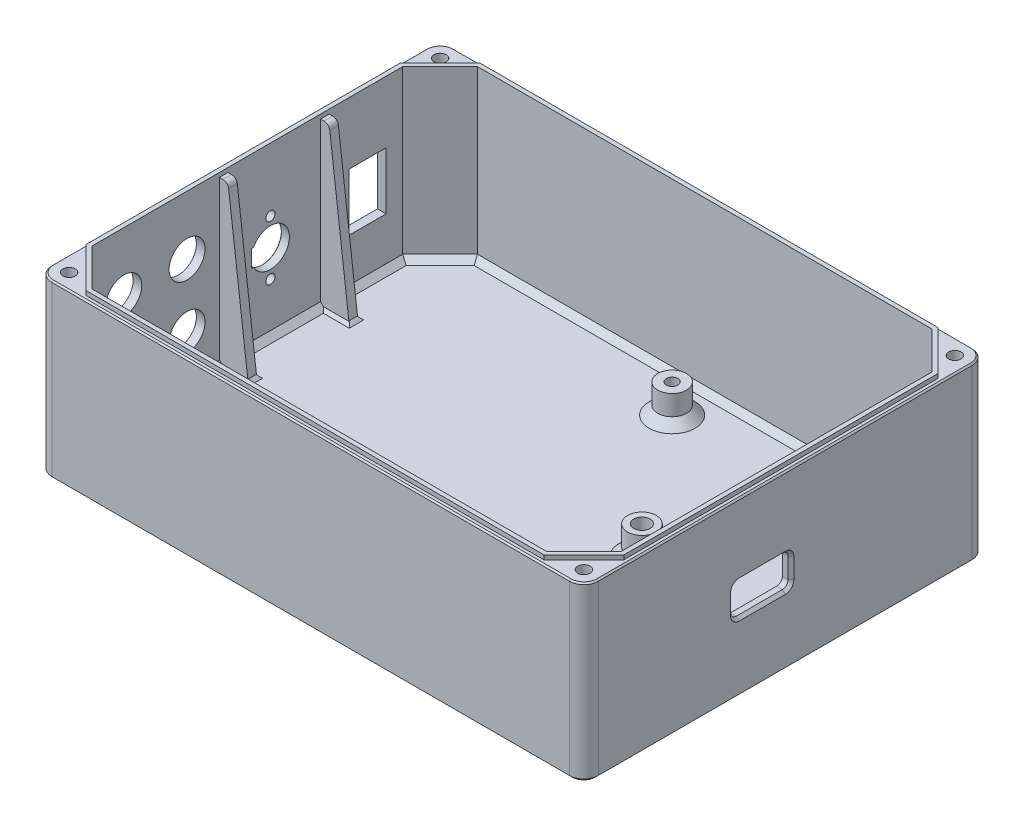
from build123d import *
from OCP.BRepFilletAPI import BRepFilletAPI_MakeChamfer

# Parameters (mm, degrees)
SKETCH2_W                      = 190
SKETCH2_H                      = 140
ENCLOSURE_BODY_DEPTH           = 60
FILLET1_R                      = 5
SHELL1_T                       = -3
SKETCH3_R                      = 5
SKETCH3_R_2                    = 2
SKETCH3_R_3                    = 2.85
PCB_SUPPORTS_DEPTH             = 10
ENCLOSURE_START                = 57
ENCLOSURE_CORNER_FLANGES_DEPTH = 57
SKETCH8_R                      = 3.8
CUT_EXTRUDE1_DEPTH             = 45.5
SKETCH9_R                      = 2.15
CUT_EXTRUDE2_DEPTH             = 127.472328989
CHAMFER1_SIZE                  = 2
USB_CUTOUT_DEPTH               = 6
SKETCH11_R                     = 1.6
SKETCH11_R_2                   = 6.25
SKETCH11_W                     = 12.9
SKETCH11_H                     = 19.9
BUTTON_CUTOUTS_DEPTH           = 6
CHAMFER3_SIZE                  = 1
SKETCH15_W                     = 3
SKETCH15_H                     = 12.65913529
SKETCH15_H_2                   = 57
BOSS_EXTRUDE6_DEPTH            = 10
CUT_EXTRUDE3_REACH             = 155.152
CHAMFER4_SIZE                  = 3
FILLET2_R                      = 2
BOSS_EXTRUDE7_DEPTH            = 1.5
CHAMFER5_SIZE                  = 1
CHAMFER5_SIZE2                 = 1.148564321
CHAMFER6_SIZE                  = 1
CHAMFER7_SIZE                  = 0.2
CHAMFER8_SIZE                  = 0.5


with BuildPart() as part:
    # Sketch2 → Enclosure body (new body)
    with BuildSketch(Plane(origin=(0, 0, 0), x_dir=(1, 0, 0), z_dir=(0, 1, 0))):
        Rectangle(SKETCH2_W, SKETCH2_H)
    extrude(amount=ENCLOSURE_BODY_DEPTH)

    # Fillet1
    fillet1_edges = [part.edges().sort_by_distance(p)[0] for p in [
        (95, 30, 70),
        (-95, 30, 70),
        (-95, 30, -70),
        (95, 30, -70),
    ]]
    fillet(fillet1_edges, radius=FILLET1_R)

    # Shell1
    shell1_openings = [part.faces().sort_by_distance(p)[0] for p in [
        (0, 60, 0),
    ]]
    offset(amount=SHELL1_T, openings=shell1_openings, kind=Kind.INTERSECTION)

    # Sketch3 → PCB Supports (add)
    # profile 1 of 5: a face of its own
    with BuildSketch(Plane(origin=(0, 3, 0), x_dir=(1, 0, 0), z_dir=(0, 1, 0))):
        with Locations(Location((1.270356621, 54.416611673, 0), (0, 0, 270))):
            Circle(SKETCH3_R)
        with Locations(Location((1.270356621, 54.416611673, 0), (0, 0, 270))):
            Circle(SKETCH3_R_2, mode=Mode.SUBTRACT)
    # profile 2 of 5: a face of its own
    with BuildSketch(Plane(origin=(0, 3, 0), x_dir=(1, 0, 0), z_dir=(0, 1, 0))):
        with Locations(Location((76.270356621, 54.416611673, 0), (0, 0, 270))):
            Circle(SKETCH3_R)
        with Locations(Location((76.270356621, 54.416611673, 0), (0, 0, 270))):
            Circle(SKETCH3_R_2, mode=Mode.SUBTRACT)
    # profile 3 of 5: a face of its own
    with BuildSketch(Plane(origin=(0, 3, 0), x_dir=(1, 0, 0), z_dir=(0, 1, 0))):
        with Locations(Location((76.270356621, -55.583388327, 0), (0, 0, 270))):
            Circle(SKETCH3_R)
        with Locations(Location((76.270356621, -55.583388327, 0), (0, 0, 270))):
            Circle(SKETCH3_R_2, mode=Mode.SUBTRACT)
    # profile 4 of 5: a face of its own
    with BuildSketch(Plane(origin=(0, 3, 0), x_dir=(1, 0, 0), z_dir=(0, 1, 0))):
        with Locations(Location((1.270356621, -55.583388327, 0), (0, 0, 270))):
            Circle(SKETCH3_R)
        with Locations(Location((1.270356621, -55.583388327, 0), (0, 0, 270))):
            Circle(SKETCH3_R_2, mode=Mode.SUBTRACT)
    # profile 5 of 5: a face of its own
    with BuildSketch(Plane(origin=(0, 3, 0), x_dir=(1, 0, 0), z_dir=(0, 1, 0))):
        with Locations(Location((38.770356621, 6.416611673, 0), (0, 0, 270))):
            Circle(SKETCH3_R)
        with Locations(Location((38.770356621, 6.416611673, 0), (0, 0, 270))):
            Circle(SKETCH3_R_3, mode=Mode.SUBTRACT)
    extrude(amount=PCB_SUPPORTS_DEPTH)

    # Sketch6 → Enclosure corner flanges (add)
    with BuildSketch(Plane(origin=(0, 3, 0), x_dir=(1, 0, 0), z_dir=(0, 1, 0)).offset(ENCLOSURE_START)):
        with BuildLine():
            Line((-79, 67), (-92, 54))
            Line((-92, 54), (-92, 65))
            ThreePointArc((-92, 65), (-91.414213562, 66.414213562), (-90, 67))
            Line((-90, 67), (-79, 67))
        make_face()
        with BuildLine():
            Line((-92, -54), (-79, -67))
            Line((-79, -67), (-90, -67))
            ThreePointArc((-90, -67), (-91.414213562, -66.414213562), (-92, -65))
            Line((-92, -65), (-92, -54))
        make_face()
        with BuildLine():
            Line((79, -67), (92, -54))
            Line((92, -54), (92, -65))
            ThreePointArc((92, -65), (91.414213562, -66.414213562), (90, -67))
            Line((90, -67), (79, -67))
        make_face()
        with BuildLine():
            Line((79, 67), (92, 54))
            Line((92, 54), (92, 65))
            ThreePointArc((92, 65), (91.414213562, 66.414213562), (90, 67))
            Line((90, 67), (79, 67))
        make_face()
    extrude(amount=-ENCLOSURE_CORNER_FLANGES_DEPTH)

    # Sketch8 → Cut-Extrude1 (cut)
    with BuildSketch(Plane.XZ):
        with Locations(Location((89.517766953, -64.517766953, 0), (0, 0, 270))):
            Circle(SKETCH8_R)
        with Locations(Location((89.517766953, 64.517766953, 0), (0, 0, 270))):
            Circle(SKETCH8_R)
        with Locations(Location((-89.517766953, 64.517766953, 0), (0, 0, 270))):
            Circle(SKETCH8_R)
        with Locations(Location((-89.517766953, -64.517766953, 0), (0, 0, 270))):
            Circle(SKETCH8_R)
    extrude(amount=-CUT_EXTRUDE1_DEPTH, mode=Mode.SUBTRACT)

    # Sketch9 → Cut-Extrude2 (cut, through all)
    with BuildSketch(Plane.XZ.offset(-45.5)):
        with Locations(Location((-89.517766953, 64.517766953, 0), (0, 0, 270))):
            Circle(SKETCH9_R)
        with Locations(Location((89.517766953, 64.517766953, 0), (0, 0, 270))):
            Circle(SKETCH9_R)
        with Locations(Location((89.517766953, -64.517766953, 0), (0, 0, 270))):
            Circle(SKETCH9_R)
        with Locations(Location((-89.517766953, -64.517766953, 0), (0, 0, 270))):
            Circle(SKETCH9_R)
    extrude(amount=-CUT_EXTRUDE2_DEPTH, mode=Mode.SUBTRACT)

    # Chamfer1
    chamfer1_edges = [part.edges().sort_by_distance(p)[0] for p in [
        (0, 3, 67),
        (92, 3, 0),
        (0, 3, -67),
        (-92, 3, 0),
        (-85.5, 3, 60.5),
        (85.5, 3, -60.5),
        (-85.5, 3, -60.5),
        (85.5, 3, 60.5),
    ]]
    chamfer(chamfer1_edges, length=CHAMFER1_SIZE)

    # Sketch10 → USB cutout (cut)
    with BuildSketch(Plane(origin=(95, 0, -30), x_dir=(0, 0, 1), z_dir=(-1, 0, 0))):
        with BuildLine():
            Line((29.983133645, 35), (45.983133645, 35))
            ThreePointArc((45.983133645, 35), (47.397347207, 34.414213562), (47.983133645, 33))
            Line((47.983133645, 33), (47.983133645, 26))
            ThreePointArc((47.983133645, 26), (47.397347207, 24.585786438), (45.983133645, 24))
            Line((45.983133645, 24), (29.983133645, 24))
            ThreePointArc((29.983133645, 24), (28.568920083, 24.585786438), (27.983133645, 26))
            Line((27.983133645, 26), (27.983133645, 33))
            ThreePointArc((27.983133645, 33), (28.568920083, 34.414213562), (29.983133645, 35))
        make_face()
    extrude(amount=USB_CUTOUT_DEPTH, mode=Mode.SUBTRACT)

    # Sketch11 → Button cutouts (cut)
    with BuildSketch(Plane.ZY.offset(95)):
        with Locations((-8, 39.5)):
            Circle(SKETCH11_R)
        with Locations((-8, 20.5)):
            Circle(SKETCH11_R)
        with Locations((21, 41)):
            Circle(SKETCH11_R_2)
        with Locations((21, 19)):
            Circle(SKETCH11_R_2)
        with Locations((43, 19)):
            Circle(SKETCH11_R_2)
        with Locations((43, 41)):
            Circle(SKETCH11_R_2)
        with BuildLine():
            Line((-2.121224617, 33), (-1.4, 33))
            Line((-1.4, 33), (-1.4, 27))
            Line((-1.4, 27), (-2.121224617, 27))
            ThreePointArc((-2.121224617, 27), (-14.6, 30), (-2.121224617, 33))
        make_face()
        with Locations((-41.773709578, 30)):
            Rectangle(SKETCH11_W, SKETCH11_H)
    extrude(amount=-BUTTON_CUTOUTS_DEPTH, mode=Mode.SUBTRACT)

    # Chamfer3
    chamfer3_edges = [part.edges().sort_by_distance(p)[0] for p in [
        (0, 0, 70),
        (95, 0, 0),
        (-95, 0, 0),
        (0, 0, -70),
        (93.535533906, 0, 68.535533906),
        (93.535533906, 0, -68.535533906),
        (-93.535533906, 0, -68.535533906),
        (-93.535533906, 0, 68.535533906),
    ]]
    chamfer(chamfer3_edges, length=CHAMFER3_SIZE)

    # Sketch15 → Boss-Extrude6 (add)
    with BuildSketch(Plane(origin=(-92, 0, 0), x_dir=(0, 0, -1), z_dir=(1, 0, 0))):
        with Locations((-32.569436541, 9.329567645)):
            Rectangle(SKETCH15_W, SKETCH15_H)
        with Locations((26.908015772, 31.5)):
            Rectangle(SKETCH15_W, SKETCH15_H_2)
        with Locations((-8.246855947, 31.5)):
            Rectangle(SKETCH15_W, SKETCH15_H_2)
    extrude(amount=BOSS_EXTRUDE6_DEPTH)

    # Cut-Extrude3: up to this face of the body (flat: up to its plane)
    cut_extrude3_end = Plane(part.part.faces().sort_by_distance((-86.984741784, 31.598004695, -28.408015772))[0])
    # Sketch16 → Cut-Extrude3 (cut, up to the picked face)
    with BuildSketch(Plane.XY.offset(34.069436541), mode=Mode.PRIVATE) as cut_extrude3_sk1:
        Polygon((-82, 60), (-82, 3), (-89, 60), align=None)
    cut_extrude3_tool1 = split(extrude(cut_extrude3_sk1.sketch, amount=-CUT_EXTRUDE3_REACH, mode=Mode.PRIVATE), bisect_by=cut_extrude3_end, keep=Keep.BOTH, mode=Mode.PRIVATE)
    add(cut_extrude3_tool1.solids().sort_by(Axis((-84.333333, 41, 34.069437), (0, 0, -1)))[0], mode=Mode.SUBTRACT)

    # Chamfer4
    chamfer4_edges = [part.edges().sort_by_distance(p)[0] for p in [
        (1.270356621, 3, 50.583388327),
        (76.270356621, 3, 50.583388327),
        (76.270356621, 3, -59.416611673),
        (1.270356621, 3, -59.416611673),
        (38.770356621, 3, -11.416611673),
    ]]
    chamfer(chamfer4_edges, length=CHAMFER4_SIZE)

    # Fillet2
    fillet2_edges = [part.edges().sort_by_distance(p)[0] for p in [
        (-89, 60, 8.246855947),
        (-89, 60, -26.908015772),
        (-83.55463065, 15.65913529, 32.569436541),
    ]]
    fillet(fillet2_edges, radius=FILLET2_R)

    # Sketch17 → Boss-Extrude7 (add)
    with BuildSketch(Plane(origin=(0, 60, 0), x_dir=(1, 0, 0), z_dir=(0, 1, 0))):
        Polygon((-93.5, 54.621320344), (-93.5, -54.621320344), (-79.621320344, -68.5), (79.621320344, -68.5), (93.5, -54.621320344), (93.5, 54.621320344), (79.621320344, 68.5), (-79.621320344, 68.5), align=None)
        Polygon((79, 67), (92, 54), (92, -54), (79, -67), (-79, -67), (-92, -54), (-92, 54), (-79, 67), align=None, mode=Mode.SUBTRACT)
    extrude(amount=BOSS_EXTRUDE7_DEPTH)

    # Chamfer5: one chamfer whose edges measure the first distance from different faces: ONE call of the kernel's chamfer builder (chamfer() names one face for all edges)
    chamfer5_edges_1 = [part.edges().sort_by_distance(p)[0] for p in [
        (-86, 3, 34.069436541),
        (-86, 3, 31.069436541),
        (-86, 3, -25.408015772),
        (-86, 3, -28.408015772),
        (-86, 3, 9.746855947),
        (-86, 3, 6.746855947),
    ]]
    chamfer5_edges_2 = [part.edges().sort_by_distance(p)[0] for p in [
        (-82, 3, 32.569436541),
        (-82, 3, -26.908015772),
        (-82, 3, 8.246855947),
    ]]
    chamfer5_side_2 = [part.faces().sort_by_distance(p)[0] for p in [
        (-1.487293538, 3, 0.022100072),
    ]]
    chamfer5 = BRepFilletAPI_MakeChamfer(part.part.solid().wrapped)
    for e in chamfer5_edges_1:
        chamfer5.Add(CHAMFER5_SIZE, e.wrapped)
    for e in chamfer5_edges_2:
        chamfer5.Add(CHAMFER5_SIZE, CHAMFER5_SIZE2, e.wrapped, chamfer5_side_2[0].wrapped)  # the first distance lies on this face
    add(Compound.cast(chamfer5.Shape()), mode=Mode.REPLACE)

    # Chamfer6
    chamfer6_edges = [part.edges().sort_by_distance(p)[0] for p in [
        (95, 34.414213562, 17.397347207),
        (95, 35, 7.983133645),
        (95, 34.414213562, -1.431079917),
        (95, 29.5, -2.016866355),
        (95, 24.585786438, -1.431079917),
        (95, 24, 7.983133645),
        (95, 24.585786438, 17.397347207),
        (95, 29.5, 17.983133645),
    ]]
    chamfer(chamfer6_edges, length=CHAMFER6_SIZE)

    # Chamfer7
    chamfer7_edges = [part.edges().sort_by_distance(p)[0] for p in [
        (-95, 30, -14.6),
    ]]
    chamfer(chamfer7_edges, length=CHAMFER7_SIZE)

    # Chamfer8
    chamfer8_edges = [part.edges().sort_by_distance(p)[0] for p in [
        (0, 60, 70),
        (-95, 60, 0),
        (95, 60, 0),
        (0, 60, -70),
        (93.535533906, 60, 68.535533906),
        (93.535533906, 60, -68.535533906),
        (-93.535533906, 60, -68.535533906),
        (-93.535533906, 60, 68.535533906),
    ]]
    chamfer(chamfer8_edges, length=CHAMFER8_SIZE)


solid = part.part
